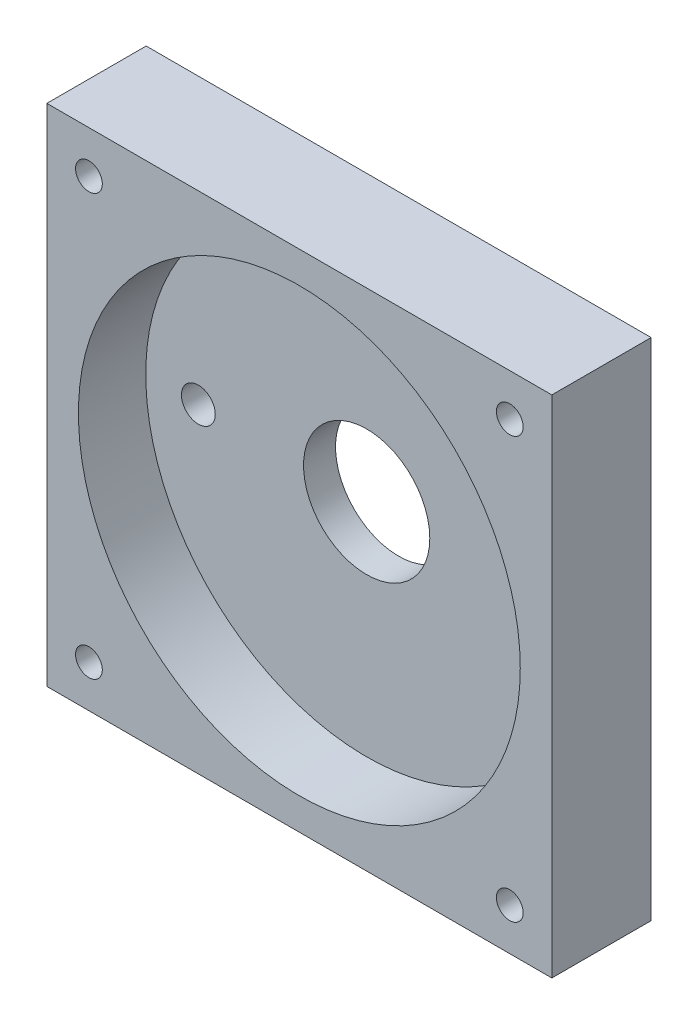
from build123d import *

# Parameters (mm, degrees)
SKETCH1_W               = 76.2
SKETCH1_H               = 76.2
BOSS_EXTRUDE1_DEPTH     = 12.7
SKETCH2_R               = 33.3375
CUT_EXTRUDE1_DEPTH      = 10.16
SKETCH3_R               = 9.525
CUT_EXTRUDE2_DEPTH      = 19.05
CUT_EXTRUDE3_DEPTH      = 55.831064188
CUT_EXTRUDE3_DEPTH_BACK = 55.831064188
SKETCH4_R               = 1.27
SKETCH4_R_2             = 2.5527
F_10_32_TAPPED_HOLE1_D  = 4.0386
BOSS_EXTRUDE2_START     = 2.286
SKETCH7_W               = 76.2
SKETCH7_H               = 76.2
SKETCH7_R               = 2.5527
SKETCH7_R_2             = 2.0193
SKETCH7_R_3             = 9.525
BOSS_EXTRUDE2_DEPTH     = 2.286


with BuildPart() as part:
    # Sketch1 → Boss-Extrude1 (new body)
    with BuildSketch(Plane.XY):
        Rectangle(SKETCH1_W, SKETCH1_H)
    extrude(amount=BOSS_EXTRUDE1_DEPTH)

    # Sketch2 → Cut-Extrude1 (cut)
    with BuildSketch(Plane.XY.offset(12.7)):
        Circle(SKETCH2_R)
    extrude(amount=-CUT_EXTRUDE1_DEPTH, mode=Mode.SUBTRACT)

    # Sketch3 → Cut-Extrude2 (cut)
    with BuildSketch(Plane.XY.offset(2.54)):
        Circle(SKETCH3_R)
    extrude(amount=-CUT_EXTRUDE2_DEPTH, mode=Mode.SUBTRACT)

    # Sketch4 → Cut-Extrude3 (cut, two sides: drawn at the far end of the back side and taken through both)
    with BuildSketch(Plane.XY.offset(2.54).offset(-CUT_EXTRUDE3_DEPTH_BACK)):
        with Locations((-31.75, 31.75)):
            Circle(SKETCH4_R)
        with Locations((31.75, 31.75)):
            Circle(SKETCH4_R)
        with Locations((31.75, -31.75)):
            Circle(SKETCH4_R)
        with Locations((-31.75, -31.75)):
            Circle(SKETCH4_R)
        with Locations((-25.4, 0)):
            Circle(SKETCH4_R_2)
        with Locations((25.4, 0)):
            Circle(SKETCH4_R_2)
    extrude(amount=CUT_EXTRUDE3_DEPTH + CUT_EXTRUDE3_DEPTH_BACK, mode=Mode.SUBTRACT)

    # #10-32 Tapped Hole1 (through all)
    with Locations(Plane.XY.offset(12.7)):
        with Locations((-31.75, 31.75), (-31.75, -31.75), (31.75, -31.75), (31.75, 31.75)):
            Hole(F_10_32_TAPPED_HOLE1_D / 2)

    # Sketch7 → Boss-Extrude2 (add)
    with BuildSketch(Plane(origin=(0, 0, 0), x_dir=(-1, 0, 0), z_dir=(0, 0, -1)).offset(BOSS_EXTRUDE2_START)):
        Rectangle(SKETCH7_W, SKETCH7_H)
        with Locations(Location((-25.4, 0, 0), (0, 0, 180))):
            Circle(SKETCH7_R, mode=Mode.SUBTRACT)
        with Locations(Location((-31.75, 31.75, 0), (0, 0, 180))):
            Circle(SKETCH7_R_2, mode=Mode.SUBTRACT)
        with Locations(Location((0, 0, 0), (0, 0, 180))):
            Circle(SKETCH7_R_3, mode=Mode.SUBTRACT)
        with Locations(Location((25.4, 0, 0), (0, 0, 180))):
            Circle(SKETCH7_R, mode=Mode.SUBTRACT)
        with Locations(Location((31.75, 31.75, 0), (0, 0, 180))):
            Circle(SKETCH7_R_2, mode=Mode.SUBTRACT)
        with Locations(Location((31.75, -31.75, 0), (0, 0, 180))):
            Circle(SKETCH7_R_2, mode=Mode.SUBTRACT)
        with Locations(Location((-31.75, -31.75, 0), (0, 0, 180))):
            Circle(SKETCH7_R_2, mode=Mode.SUBTRACT)
    extrude(amount=-BOSS_EXTRUDE2_DEPTH)


solid = part.part
